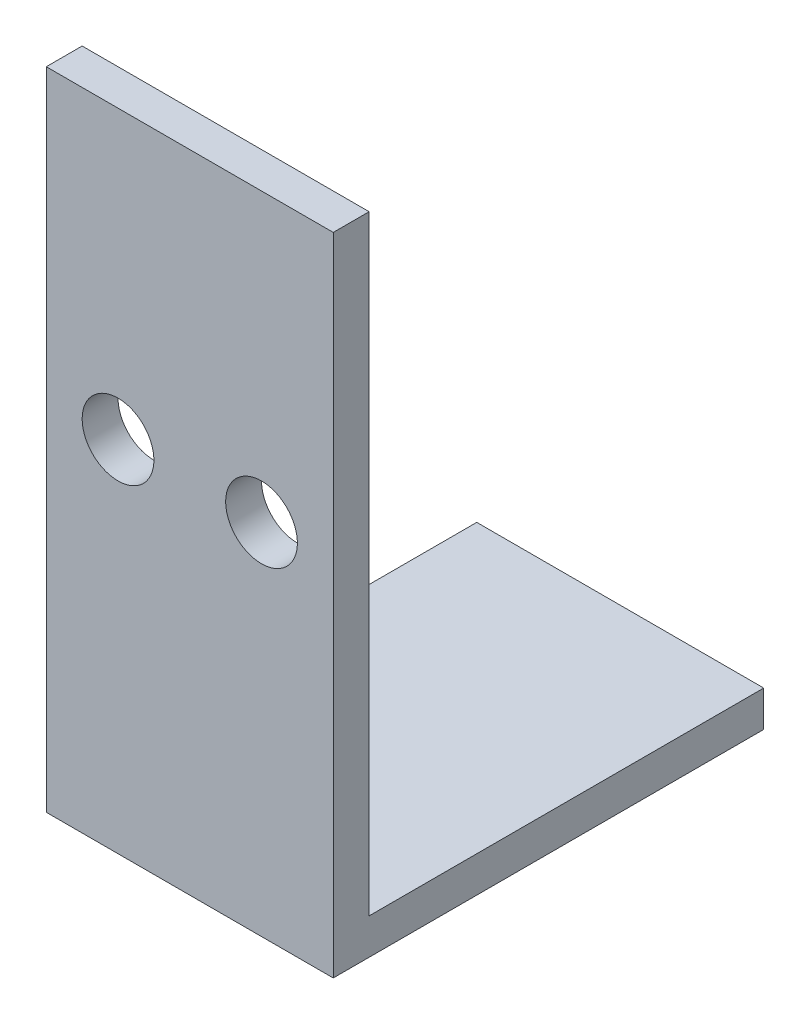
from build123d import *

# Parameters (mm, degrees)
BOSS_EXTRUDE1_DEPTH = 25.4
SKETCH2_R           = 3.175
CUT_EXTRUDE1_DEPTH  = 72.631264997


with BuildPart() as part:
    # Sketch1 → Boss-Extrude1 (new body)
    with BuildSketch(Plane(origin=(0, 0, 0), x_dir=(0, 0, -1), z_dir=(1, 0, 0))):
        Polygon((38.1, 0), (38.1, 3.175), (3.175, 3.175), (3.175, 57.15), (0, 57.15), (0, 0), align=None)
    extrude(amount=BOSS_EXTRUDE1_DEPTH)

    # Sketch2 → Cut-Extrude1 (cut, through all)
    with BuildSketch(Plane(origin=(0, 0, -3.175), x_dir=(-1, 0, 0), z_dir=(0, 0, -1))):
        with Locations((-19.05, 31.75)):
            Circle(SKETCH2_R)
        with Locations((-6.35, 31.75)):
            Circle(SKETCH2_R)
    extrude(amount=-CUT_EXTRUDE1_DEPTH, mode=Mode.SUBTRACT)


solid = part.part
